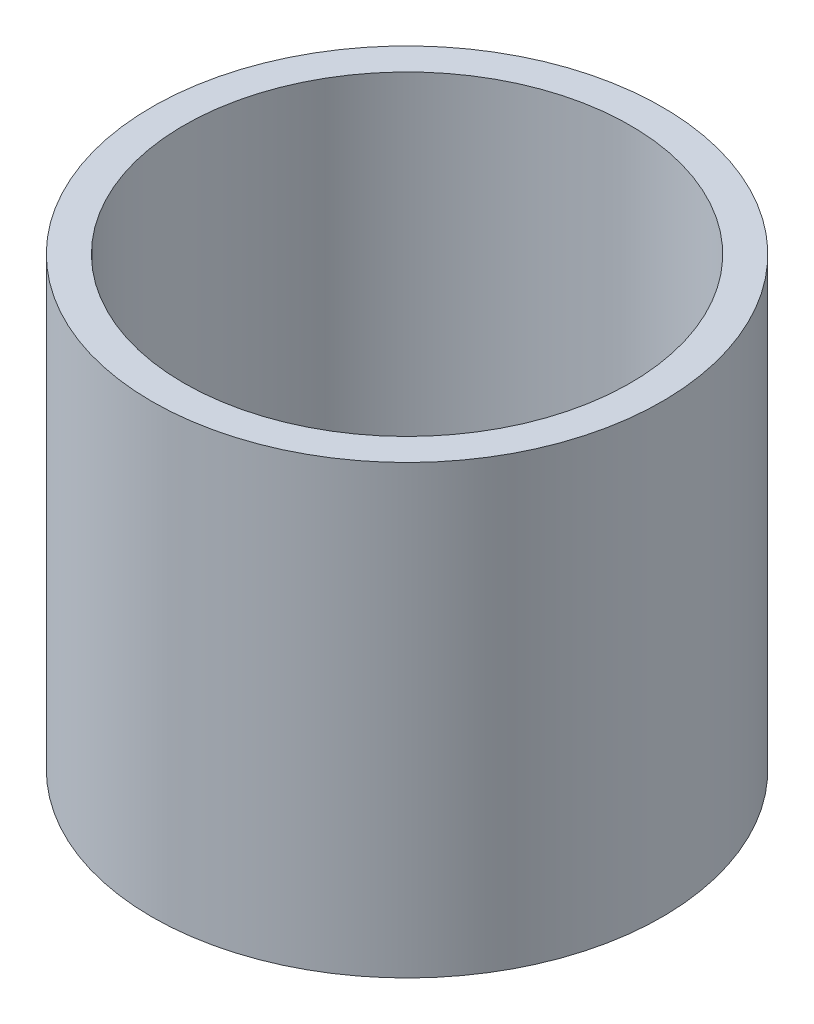
from build123d import *

# Parameters (mm, degrees)
SKETCH1_R           = 12.7
SKETCH1_R_2         = 11.1125
BOSS_EXTRUDE1_DEPTH = 22.225


with BuildPart() as part:
    # Sketch1 → Boss-Extrude1 (new body)
    with BuildSketch(Plane(origin=(0, 0, 0), x_dir=(1, 0, 0), z_dir=(0, 1, 0))):
        with Locations(Location((0, 0, 0), (0, 0, 270))):
            Circle(SKETCH1_R)
        with Locations(Location((0, 0, 0), (0, 0, 270))):
            Circle(SKETCH1_R_2, mode=Mode.SUBTRACT)
    extrude(amount=BOSS_EXTRUDE1_DEPTH)


solid = part.part
